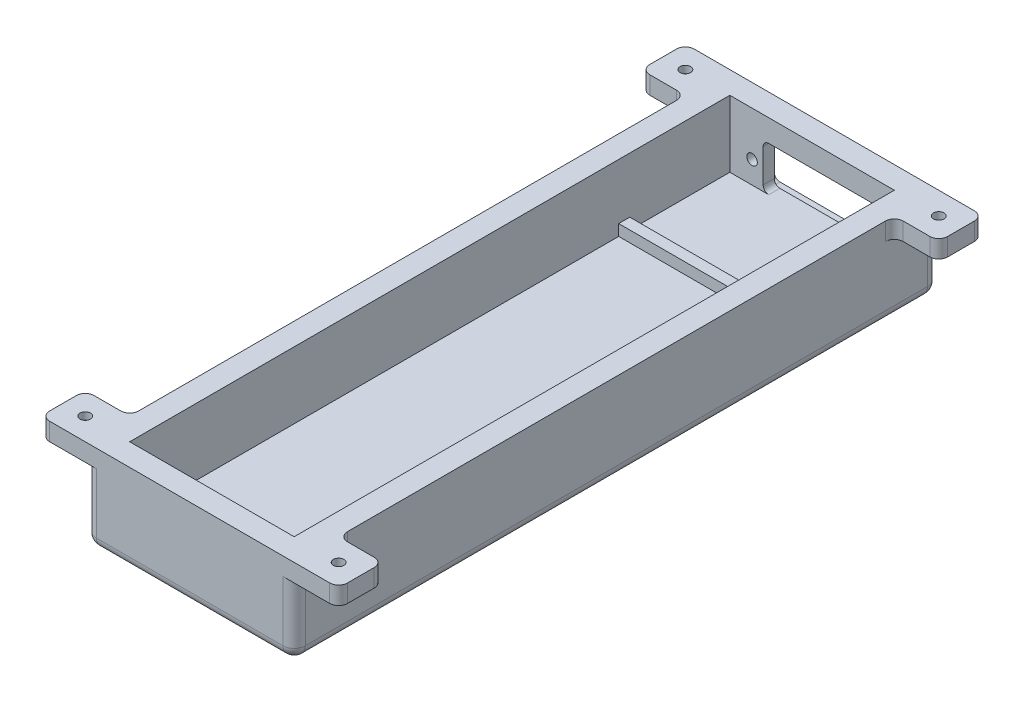
from build123d import *

# Parameters (mm, degrees)
SKETCH1_W                                           = 59.69
SKETCH1_H                                           = 184.15
BOSS_EXTRUDE1_DEPTH                                 = 25.4
SHELL1_T                                            = -6.35
SKETCH2_W                                           = 46.99
SKETCH2_H                                           = 3.175
BOSS_EXTRUDE2_DEPTH                                 = 3.175
SKETCH3_W                                           = 12.7
SKETCH3_H                                           = 12.7
BOSS_EXTRUDE3_DEPTH                                 = 5.08
FILLET1_R                                           = 2.54
CBORE_FOR_00_BINDING_HEAD_MACHINE_SCREW_D           = 3.000000096
CBORE_FOR_00_BINDING_HEAD_MACHINE_SCREW_CBORE_D     = 5.999999938
CBORE_FOR_00_BINDING_HEAD_MACHINE_SCREW_CBORE_DEPTH = 3.000000096
SKETCH8_W                                           = 37.465
SKETCH8_H                                           = 15.875
CUT_EXTRUDE1_DEPTH                                  = 3.175
CUT_EXTRUDE2_REACH                                  = 189.636
SKETCH9_R                                           = 1.5
SKETCH9_W                                           = 32.7025
SKETCH9_H                                           = 12.7
FILLET2_R                                           = 1.5875
SKETCH10_W                                          = 4.7625
SKETCH10_H                                          = 4.7625
CUT_EXTRUDE3_DEPTH                                  = 4.7625
FILLET4_R                                           = 3.175


with BuildPart() as part:
    # Sketch1 → Boss-Extrude1 (new body)
    with BuildSketch(Plane(origin=(0, 0, 0), x_dir=(1, 0, 0), z_dir=(0, 1, 0))):
        with Locations((0, 15.875)):
            Rectangle(SKETCH1_W, SKETCH1_H)
    extrude(amount=BOSS_EXTRUDE1_DEPTH)

    # Shell1
    shell1_openings = [part.faces().sort_by_distance(p)[0] for p in [
        (0, 25.4, -15.875),
    ]]
    offset(amount=SHELL1_T, openings=shell1_openings, kind=Kind.INTERSECTION)

    # Sketch2 → Boss-Extrude2 (add)
    with BuildSketch(Plane(origin=(0, 6.35, 0), x_dir=(1, 0, 0), z_dir=(0, 1, 0))):
        with Locations((0, 71.4375)):
            Rectangle(SKETCH2_W, SKETCH2_H)
    extrude(amount=BOSS_EXTRUDE2_DEPTH)

    # Sketch3 → Boss-Extrude3 (add)
    with BuildSketch(Plane(origin=(0, 25.4, 0), x_dir=(1, 0, 0), z_dir=(0, 1, 0))):
        with Locations((-36.195, 101.6)):
            Rectangle(SKETCH3_W, SKETCH3_H)
        with Locations((-36.195, -69.85)):
            Rectangle(SKETCH3_W, SKETCH3_H)
        with Locations((36.195, -69.85)):
            Rectangle(SKETCH3_W, SKETCH3_H)
        with Locations((36.195, 101.6)):
            Rectangle(SKETCH3_W, SKETCH3_H)
    extrude(amount=-BOSS_EXTRUDE3_DEPTH)

    # Fillet1
    fillet1_edges = [part.edges().sort_by_distance(p)[0] for p in [
        (-29.845, 22.86, -95.25),
        (-42.545, 22.86, -95.25),
        (-42.545, 22.86, -107.95),
        (-29.845, 22.86, 63.5),
        (-42.545, 22.86, 76.2),
        (-42.545, 22.86, 63.5),
        (42.545, 22.86, 76.2),
        (29.845, 22.86, 63.5),
        (42.545, 22.86, 63.5),
        (42.545, 22.86, -107.95),
        (42.545, 22.86, -95.25),
        (29.845, 22.86, -95.25),
    ]]
    fillet(fillet1_edges, radius=FILLET1_R)

    # CBORE for #00 Binding Head Machine Screw1 (through all)
    with Locations(Plane(origin=(0, 20.32, 0), x_dir=(-1, 0, 0), z_dir=(0, -1, 0))):
        with Locations((-36.195, -69.85), (36.195, -69.85), (36.195, 101.6), (-36.195, 101.6)):
            CounterBoreHole(CBORE_FOR_00_BINDING_HEAD_MACHINE_SCREW_D / 2, CBORE_FOR_00_BINDING_HEAD_MACHINE_SCREW_CBORE_D / 2, CBORE_FOR_00_BINDING_HEAD_MACHINE_SCREW_CBORE_DEPTH)

    # Sketch8 → Cut-Extrude1 (cut)
    with BuildSketch(Plane(origin=(0, 0, -107.95), x_dir=(-1, 0, 0), z_dir=(0, 0, -1))):
        with BuildLine():
            ThreePointArc((17.145, 7.9375), (21.9075, 12.7), (17.145, 17.4625))
            Line((17.145, 17.4625), (17.145, 7.9375))
        make_face()
        with Locations((-1.5875, 12.7)):
            Rectangle(SKETCH8_W, SKETCH8_H)
    extrude(amount=-CUT_EXTRUDE1_DEPTH, mode=Mode.SUBTRACT)

    # Sketch9 → Cut-Extrude2 (cut, up to next)
    with BuildSketch(Plane(origin=(0, 0, -104.775), x_dir=(-1, 0, 0), z_dir=(0, 0, -1)), mode=Mode.PRIVATE) as cut_extrude2_sk1:
        with Locations((17.145, 12.7)):
            Circle(SKETCH9_R)
    cut_extrude2_tool1 = extrude(cut_extrude2_sk1.sketch, amount=-CUT_EXTRUDE2_REACH, mode=Mode.PRIVATE) & part.part
    # Sketch9 → Cut-Extrude2 (cut, up to next)
    with BuildSketch(Plane(origin=(0, 0, -104.775), x_dir=(-1, 0, 0), z_dir=(0, 0, -1)), mode=Mode.PRIVATE) as cut_extrude2_sk2:
        with Locations((-2.38125, 12.7)):
            Rectangle(SKETCH9_W, SKETCH9_H)
    cut_extrude2_tool2 = extrude(cut_extrude2_sk2.sketch, amount=-CUT_EXTRUDE2_REACH, mode=Mode.PRIVATE) & part.part
    add(cut_extrude2_tool1.solids().sort_by_distance((-17.145, 12.7, -104.775))[0], mode=Mode.SUBTRACT)
    add(cut_extrude2_tool2.solids().sort_by_distance((2.38125, 12.7, -104.775))[0], mode=Mode.SUBTRACT)

    # Fillet2
    fillet2_edges = [part.edges().sort_by_distance(p)[0] for p in [
        (-17.145, 4.7625, -106.3625),
        (20.32, 4.7625, -106.3625),
        (20.32, 20.6375, -106.3625),
        (-17.145, 20.6375, -106.3625),
        (18.7325, 19.05, -103.1875),
        (18.7325, 6.35, -103.1875),
        (-13.97, 6.35, -103.1875),
        (-13.97, 19.05, -103.1875),
    ]]
    fillet(fillet2_edges, radius=FILLET2_R)

    # Sketch10 → Cut-Extrude3 (cut)
    with BuildSketch(Plane.XY.offset(-101.6)):
        with Locations((21.11375, 12.7)):
            Rectangle(SKETCH10_W, SKETCH10_H)
    extrude(amount=-CUT_EXTRUDE3_DEPTH, mode=Mode.SUBTRACT)

    # Fillet4
    fillet4_edges = [part.edges().sort_by_distance(p)[0] for p in [
        (-29.845, 10.16, -107.95),
        (-29.845, 10.16, 76.2),
        (29.845, 0, -15.875),
        (0, 0, 76.2),
        (29.845, 10.16, 76.2),
        (-29.845, 0, -15.875),
        (0, 0, -107.95),
        (29.845, 10.16, -107.95),
    ]]
    fillet(fillet4_edges, radius=FILLET4_R)


solid = part.part
